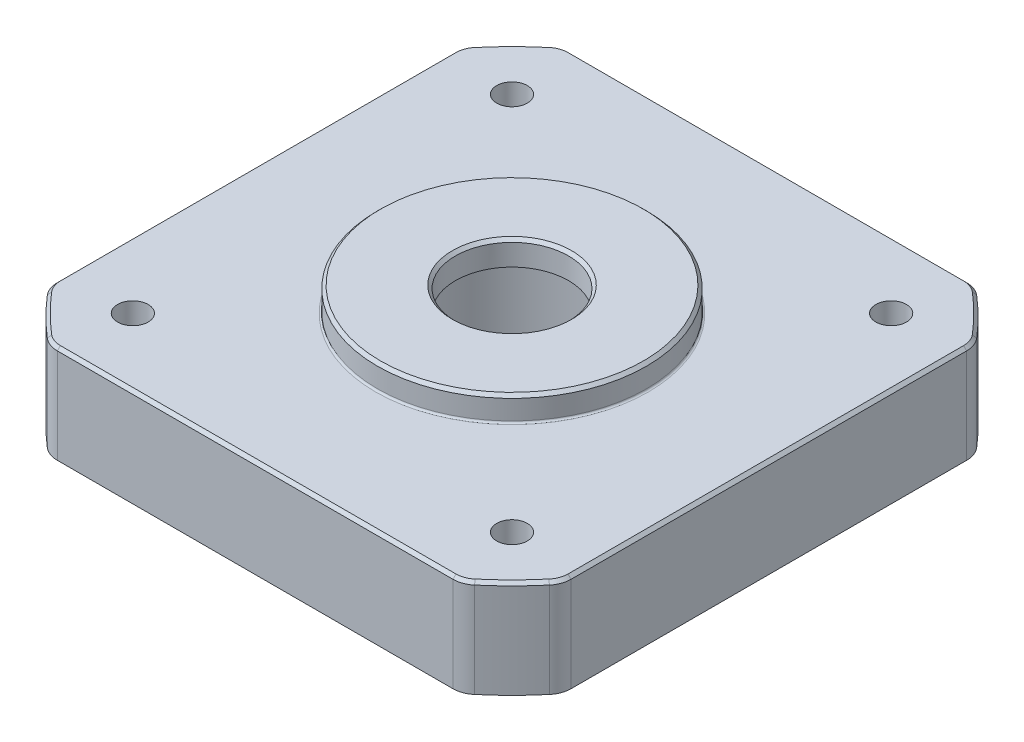
from build123d import *

# Parameters (mm, degrees)
BOSS_EXTRUDE1_DEPTH            = 8
CUT_EXTRUDE1_DEPTH             = 7
SKETCH3_R                      = 11
BOSS_EXTRUDE2_DEPTH            = 2
SKETCH4_R                      = 12.925
BOSS_EXTRUDE3_DEPTH            = 8
SKETCH5_R                      = 8.025
CUT_EXTRUDE2_DEPTH             = 31.757112998
SKETCH6_R                      = 6.125
CUT_EXTRUDE3_DEPTH             = 32.032241298
M8_CLEARANCE_HOLE1_D           = 9.25
M8_CLEARANCE_HOLE1_DEPTH       = 11
F_2_5_2_5_DIAMETER_HOLE1_D     = 2.5
F_2_5_2_5_DIAMETER_HOLE1_DEPTH = 10
FILLET1_R                      = 0.150000001
FILLET2_R                      = 0.5
CHAMFER1_SIZE                  = 0.5
CHAMFER1_SIZE2                 = 1
CHAMFER2_SIZE                  = 0.25
CHAMFER3_SIZE                  = 0.25


with BuildPart() as part:
    # Sketch1 → Boss-Extrude1 (new body)
    with BuildSketch(Plane.XZ):
        with BuildLine():
            Line((16.171038928, 21), (-16.171038928, 21))
            ThreePointArc((-16.171038928, 21), (-16.861657425, 20.876977915), (-17.467314594, 20.523046092))
            ThreePointArc((-17.467314594, 20.523046092), (-19.056527753, 19.056527753), (-20.523046092, 17.467314594))
            ThreePointArc((-20.523046092, 17.467314594), (-20.876977915, 16.861657425), (-21, 16.171038928))
            Line((-21, 16.171038928), (-21, -16.171038928))
            ThreePointArc((-21, -16.171038928), (-20.876977915, -16.861657425), (-20.523046092, -17.467314594))
            ThreePointArc((-20.523046092, -17.467314594), (-19.056527753, -19.056527753), (-17.467314594, -20.523046092))
            ThreePointArc((-17.467314594, -20.523046092), (-16.861657425, -20.876977915), (-16.171038928, -21))
            Line((-16.171038928, -21), (16.171038928, -21))
            ThreePointArc((16.171038928, -21), (16.861657424, -20.876977915), (17.467314593, -20.523046092))
            ThreePointArc((17.467314593, -20.523046092), (19.056527753, -19.056527753), (20.523046092, -17.467314593))
            ThreePointArc((20.523046092, -17.467314593), (20.876977914, -16.861657425), (21, -16.171038928))
            Line((21, -16.171038928), (21, 16.171038928))
            ThreePointArc((21, 16.171038928), (20.876977914, 16.861657425), (20.523046092, 17.467314593))
            ThreePointArc((20.523046092, 17.467314593), (19.056527753, 19.056527753), (17.467314593, 20.523046092))
            ThreePointArc((17.467314593, 20.523046092), (16.861657424, 20.876977915), (16.171038928, 21))
        make_face()
    extrude(amount=-BOSS_EXTRUDE1_DEPTH)

    # Sketch2 → Cut-Extrude1 (cut)
    with BuildSketch(Plane.XZ):
        Polygon((-19.5, 8.077164467), (-19.5, -8.077164467), (-8.077164467, -19.5), (8.077164467, -19.5), (19.5, -8.077164467), (19.5, 8.077164467), (8.077164467, 19.5), (-8.077164467, 19.5), align=None)
    extrude(amount=-CUT_EXTRUDE1_DEPTH, mode=Mode.SUBTRACT)

    # Sketch3 → Boss-Extrude2 (add)
    with BuildSketch(Plane(origin=(0, 8, 0), x_dir=(-1, 0, 0), z_dir=(0, 1, 0))):
        with Locations(Location((0, 0, 0), (0, 0, 270))):
            Circle(SKETCH3_R)
    extrude(amount=BOSS_EXTRUDE2_DEPTH)

    # Sketch4 → Boss-Extrude3 (add)
    with BuildSketch(Plane.XZ.offset(-7)):
        with Locations(Location((0, 0, 0), (0, 0, 270))):
            Circle(SKETCH4_R)
    extrude(amount=BOSS_EXTRUDE3_DEPTH)

    # Sketch5 → Cut-Extrude2 (cut, through all)
    with BuildSketch(Plane(origin=(0, 7, 0), x_dir=(1, 0, 0), z_dir=(0, 1, 0))):
        with Locations(Location((0, 0, 0), (0, 0, 90))):
            Circle(SKETCH5_R)
    extrude(amount=-CUT_EXTRUDE2_DEPTH, mode=Mode.SUBTRACT)

    # Sketch6 → Cut-Extrude3 (cut, through all)
    with BuildSketch(Plane(origin=(0, 8, 0), x_dir=(1, 0, 0), z_dir=(0, 1, 0))):
        with Locations(Location((0, 0, 0), (0, 0, 90))):
            Circle(SKETCH6_R)
    extrude(amount=-CUT_EXTRUDE3_DEPTH, mode=Mode.SUBTRACT)

    # M8 Clearance Hole1
    with Locations(Plane(origin=(0, 10, 0), x_dir=(1, 0, 0), z_dir=(0, 1, 0))):
        with Locations((0, 0)):
            Hole(M8_CLEARANCE_HOLE1_D / 2, depth=M8_CLEARANCE_HOLE1_DEPTH)

    # Ø2.5 (2.5) Diameter Hole1
    with Locations(Plane(origin=(0, 0, 0), x_dir=(-1, 0, 0), z_dir=(0, -1, 0))):
        with Locations((15.5, 15.5), (-15.5, -15.5), (-15.5, 15.5), (15.5, -15.5)):
            Hole(F_2_5_2_5_DIAMETER_HOLE1_D / 2, depth=F_2_5_2_5_DIAMETER_HOLE1_DEPTH)

    # Fillet1
    fillet1_edges = [part.edges().sort_by_distance(p)[0] for p in [
        (0, 8, 11),
        (0, 7, 12.925),
    ]]
    fillet(fillet1_edges, radius=FILLET1_R)

    # Fillet2
    fillet2_edges = [part.edges().sort_by_distance(p)[0] for p in [
        (-19.5, 3.5, 8.077164467),
        (-8.077164467, 3.5, 19.5),
        (8.077164467, 3.5, 19.5),
        (19.5, 3.5, 8.077164467),
        (19.5, 3.5, -8.077164467),
        (8.077164467, 3.5, -19.5),
        (-8.077164467, 3.5, -19.5),
        (-19.5, 3.5, -8.077164467),
    ]]
    fillet(fillet2_edges, radius=FILLET2_R)

    # Chamfer1
    chamfer1_edges = [part.edges().sort_by_distance(p)[0] for p in [
        (0, -1, 8.025),
    ]]
    chamfer1_side = [part.faces().sort_by_distance(p)[0] for p in [
        (0, -1, 12.559425794),
    ]]
    chamfer(chamfer1_edges, length=CHAMFER1_SIZE, length2=CHAMFER1_SIZE2, reference=chamfer1_side[0])

    # Chamfer2
    chamfer2_edges = [part.edges().sort_by_distance(p)[0] for p in [
        (16.861657424, 8, 20.876977915),
        (0, 8, 21),
        (-16.861657425, 8, 20.876977915),
        (-19.056527753, 8, 19.056527753),
        (-20.876977915, 8, 16.861657425),
        (-21, 8, 0),
        (-20.876977915, 8, -16.861657425),
        (-19.056527753, 8, -19.056527753),
        (-16.861657425, 8, -20.876977915),
        (0, 8, -21),
        (20.876977914, 8, 16.861657425),
        (16.861657424, 8, -20.876977915),
        (19.056527753, 8, -19.056527753),
        (20.876977914, 8, -16.861657425),
        (21, 8, 0),
        (19.056527753, 8, 19.056527753),
    ]]
    chamfer(chamfer2_edges, length=CHAMFER2_SIZE)

    # Chamfer3
    chamfer3_edges = [part.edges().sort_by_distance(p)[0] for p in [
        (0, 10, 11),
        (0, -1, 12.925),
        (0, 7, 6.125),
        (4.625, 10, 0),
    ]]
    chamfer(chamfer3_edges, length=CHAMFER3_SIZE)


solid = part.part
